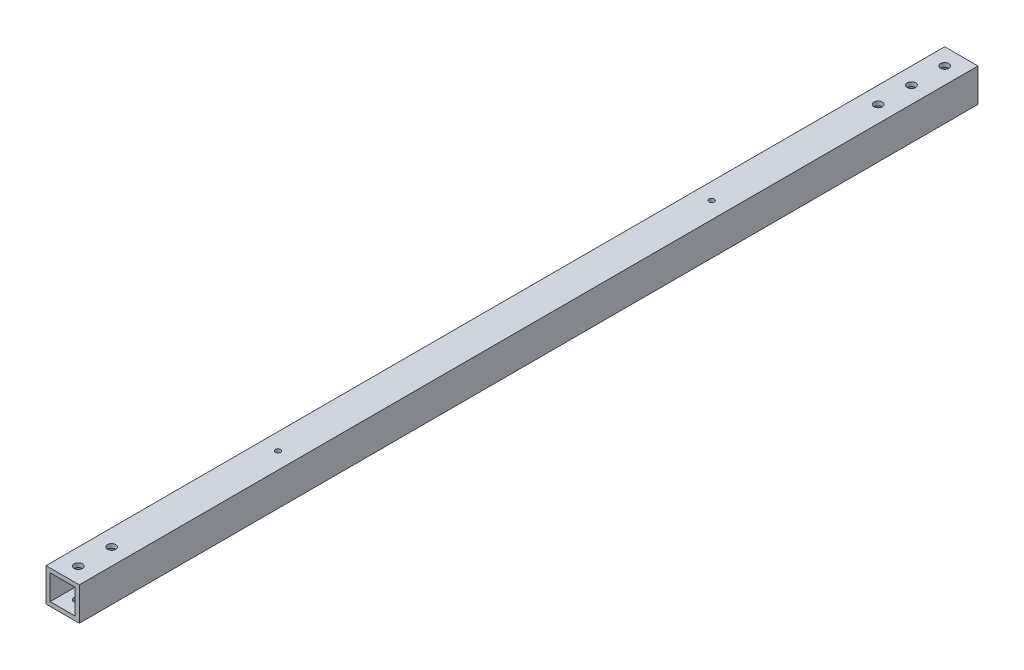
from build123d import *

# Parameters (mm, degrees)
BOSS_EXTRUDE1_DEPTH                  = 342.9
BOSS_EXTRUDE1_DEPTH_BACK             = 342.9
SKETCH3_W                            = 25.4
SKETCH3_H                            = 25.4
SKETCH3_W_2                          = 19.05
SKETCH3_H_2                          = 19.05
F_5_32_0_15625_DIAMETER_HOLE1_D      = 3.96875
F_1_4_0_25_DIAMETER_HOLE1_AT_2_COUNT = 2
F_1_4_0_25_DIAMETER_HOLE1_AT_2_PITCH = 25.4
F_1_4_0_25_DIAMETER_HOLE1_AT_3_COUNT = 2
F_1_4_0_25_DIAMETER_HOLE1_AT_3_PITCH = 50.8
F_1_4_0_25_DIAMETER_HOLE2_AT_2_COUNT = 2
F_1_4_0_25_DIAMETER_HOLE2_AT_2_PITCH = 25.4


with BuildPart() as part:
    # Sketch3 → Boss-Extrude1 (new, two sides: drawn at the far end of the back side and taken through both)
    with BuildSketch(Plane.XY.offset(-BOSS_EXTRUDE1_DEPTH_BACK)):
        Rectangle(SKETCH3_W, SKETCH3_H)
        Rectangle(SKETCH3_W_2, SKETCH3_H_2, mode=Mode.SUBTRACT)
    extrude(amount=BOSS_EXTRUDE1_DEPTH + BOSS_EXTRUDE1_DEPTH_BACK)

    # 5/32 (0.15625) Diameter Hole1 (through all)
    with Locations(Plane(origin=(0, 12.7, 0), x_dir=(1, 0, 0), z_dir=(0, 1, 0))):
        with Locations((0, 152.4), (0, -178.5118096)):
            Hole(F_5_32_0_15625_DIAMETER_HOLE1_D / 2)

    # Sketch9 → 1/4 (0.25) Diameter Hole1 (revolve, cut)
    with BuildSketch(Plane(origin=(0, 12.7, -330.2), x_dir=(0, 0, 1), z_dir=(1, 0, 0))):
        Polygon((0, 0), (0, 25.4), (3.9624, 25.4), (3.175, 24.494199916), (3.175, 0), align=None)
    f_1_4_0_25_diameter_hole1 = revolve(axis=Axis((0, 19.05, -330.2), (0, -1, 0)), mode=Mode.SUBTRACT)

    # 1/4 (0.25) Diameter Hole1 at 2: 1/4 (0.25) Diameter Hole1 ×2
    with Locations(*[(0, 0, i * F_1_4_0_25_DIAMETER_HOLE1_AT_2_PITCH) for i in range(1, F_1_4_0_25_DIAMETER_HOLE1_AT_2_COUNT)]):
        add(f_1_4_0_25_diameter_hole1, mode=Mode.SUBTRACT)

    # 1/4 (0.25) Diameter Hole1 at 3: 1/4 (0.25) Diameter Hole1 ×2
    with Locations(*[(0, 0, i * F_1_4_0_25_DIAMETER_HOLE1_AT_3_PITCH) for i in range(1, F_1_4_0_25_DIAMETER_HOLE1_AT_3_COUNT)]):
        add(f_1_4_0_25_diameter_hole1, mode=Mode.SUBTRACT)

    # Sketch12 → 1/4 (0.25) Diameter Hole2 (revolve, cut)
    with BuildSketch(Plane(origin=(0, 12.7, 330.911799988), x_dir=(0, 0, 1), z_dir=(1, 0, 0))):
        Polygon((0, 0), (0, 25.4), (3.9624, 25.4), (3.175, 24.494199916), (3.175, 0), align=None)
    f_1_4_0_25_diameter_hole2 = revolve(axis=Axis((0, 19.05, 330.911799988), (0, -1, 0)), mode=Mode.SUBTRACT)

    # 1/4 (0.25) Diameter Hole2 at 2: 1/4 (0.25) Diameter Hole2 ×2
    with Locations(*[(0, 0, -i * F_1_4_0_25_DIAMETER_HOLE2_AT_2_PITCH) for i in range(1, F_1_4_0_25_DIAMETER_HOLE2_AT_2_COUNT)]):
        add(f_1_4_0_25_diameter_hole2, mode=Mode.SUBTRACT)


solid = part.part
